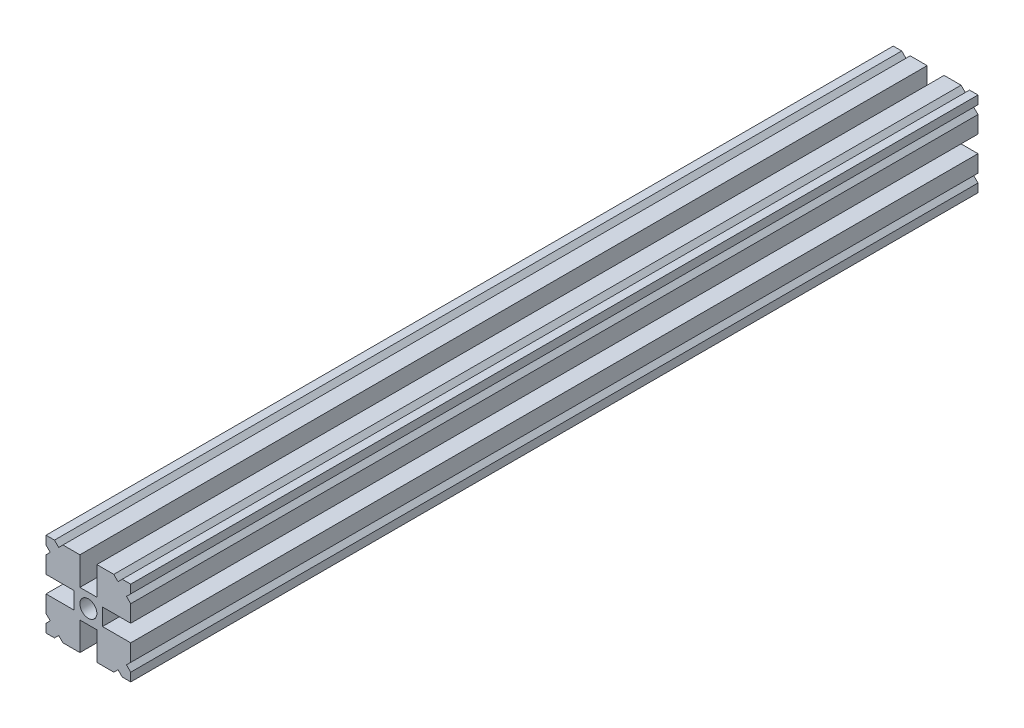
from build123d import *

# Parameters (mm, degrees)
SKETCH1_R           = 1.5
BOSS_EXTRUDE1_DEPTH = 150


with BuildPart() as part:
    # Sketch1 → Boss-Extrude1 (new body)
    with BuildSketch(Plane.XY):
        Polygon((-7.5, 7.5), (-6, 7.5), (-5.25, 6.75), (-4.5, 7.5), (-1.5, 7.5), (-1.5, 2.5), (1.5, 2.5), (1.5, 7.5), (4.5, 7.5), (5.25, 6.75), (6, 7.5), (7.5, 7.5), (7.5, 6), (6.75, 5.25), (7.5, 4.5), (7.5, 1.5), (2.5, 1.5), (2.5, -1.5), (7.5, -1.5), (7.5, -4.5), (6.75, -5.25), (7.5, -6), (7.5, -7.5), (6, -7.5), (5.25, -6.75), (4.5, -7.5), (1.5, -7.5), (1.5, -2.5), (-1.5, -2.5), (-1.5, -7.5), (-4.5, -7.5), (-5.25, -6.75), (-6, -7.5), (-7.5, -7.5), (-7.5, -6), (-6.75, -5.25), (-7.5, -4.5), (-7.5, -1.5), (-2.5, -1.5), (-2.5, 1.5), (-7.5, 1.5), (-7.5, 4.5), (-6.75, 5.25), (-7.5, 6), align=None)
        Circle(SKETCH1_R, mode=Mode.SUBTRACT)
    extrude(amount=BOSS_EXTRUDE1_DEPTH)


solid = part.part
